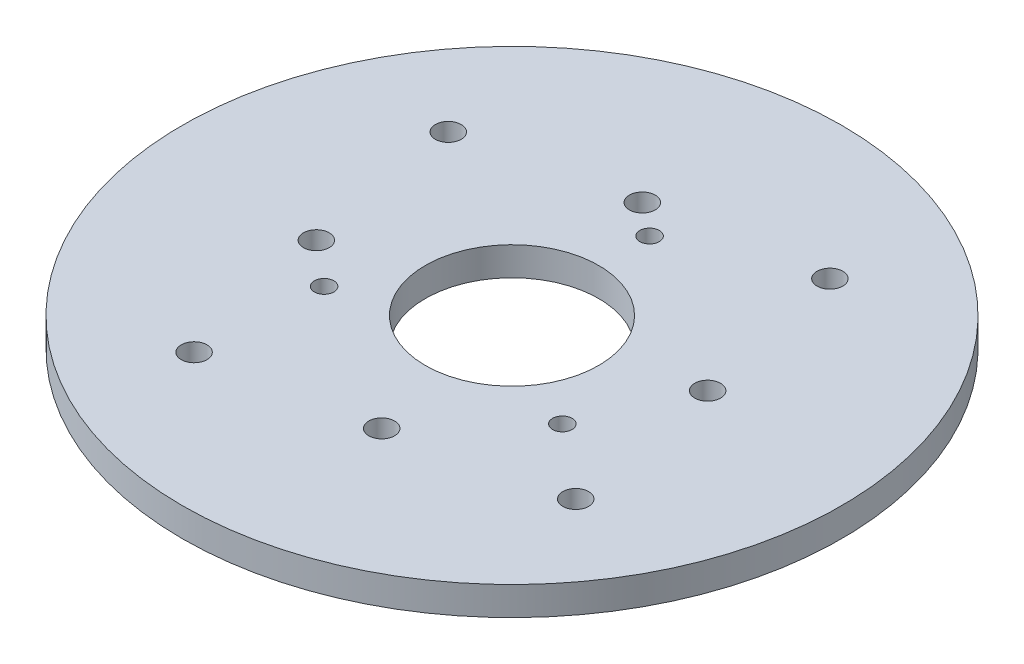
from build123d import *

# Parameters (mm, degrees)
SKETCH1_R           = 57.5
SKETCH1_R_2         = 15.125
SKETCH1_R_3         = 2.25
BOSS_EXTRUDE1_DEPTH = 5
SKETCH3_R           = 1.7
CUT_EXTRUDE1_DEPTH  = 82.470853684


with BuildPart() as part:
    # Sketch1 → Boss-Extrude1 (new body)
    with BuildSketch(Plane(origin=(0, 0, 0), x_dir=(1, 0, 0), z_dir=(0, 1, 0))):
        with Locations(Location((0, 0, 0), (0, 0, 270))):
            Circle(SKETCH1_R)
        with Locations(Location((0, 0, 0), (0, 0, 270))):
            Circle(SKETCH1_R_2, mode=Mode.SUBTRACT)
        with Locations(Location((5.699343677, -28.434441821, 0), (0, 0, 270))):
            Circle(SKETCH1_R_3, mode=Mode.SUBTRACT)
        with Locations(Location((33.29135337, -22.173989059, 0), (0, 0, 270))):
            Circle(SKETCH1_R_3, mode=Mode.SUBTRACT)
        with Locations(Location((-28.434441821, -5.699343677, 0), (0, 0, 270))):
            Circle(SKETCH1_R_3, mode=Mode.SUBTRACT)
        with Locations(Location((-22.173989059, -33.29135337, 0), (0, 0, 270))):
            Circle(SKETCH1_R_3, mode=Mode.SUBTRACT)
        with Locations(Location((-5.699343677, 28.434441821, 0), (0, 0, 270))):
            Circle(SKETCH1_R_3, mode=Mode.SUBTRACT)
        with Locations(Location((-33.29135337, 22.173989059, 0), (0, 0, 270))):
            Circle(SKETCH1_R_3, mode=Mode.SUBTRACT)
        with Locations(Location((28.434441821, 5.699343677, 0), (0, 0, 270))):
            Circle(SKETCH1_R_3, mode=Mode.SUBTRACT)
        with Locations(Location((22.173989059, 33.29135337, 0), (0, 0, 270))):
            Circle(SKETCH1_R_3, mode=Mode.SUBTRACT)
    extrude(amount=BOSS_EXTRUDE1_DEPTH)

    # Sketch3 → Cut-Extrude1 (cut, through all)
    with BuildSketch(Plane(origin=(0, 5, 0), x_dir=(1, 0, 0), z_dir=(0, 1, 0))):
        with Locations(Location((0, 24, 0), (0, 0, 270))):
            Circle(SKETCH3_R)
        with Locations(Location((20.784609691, -12, 0), (0, 0, 270))):
            Circle(SKETCH3_R)
        with Locations(Location((-20.784609691, -12, 0), (0, 0, 270))):
            Circle(SKETCH3_R)
    extrude(amount=-CUT_EXTRUDE1_DEPTH, mode=Mode.SUBTRACT)


solid = part.part
